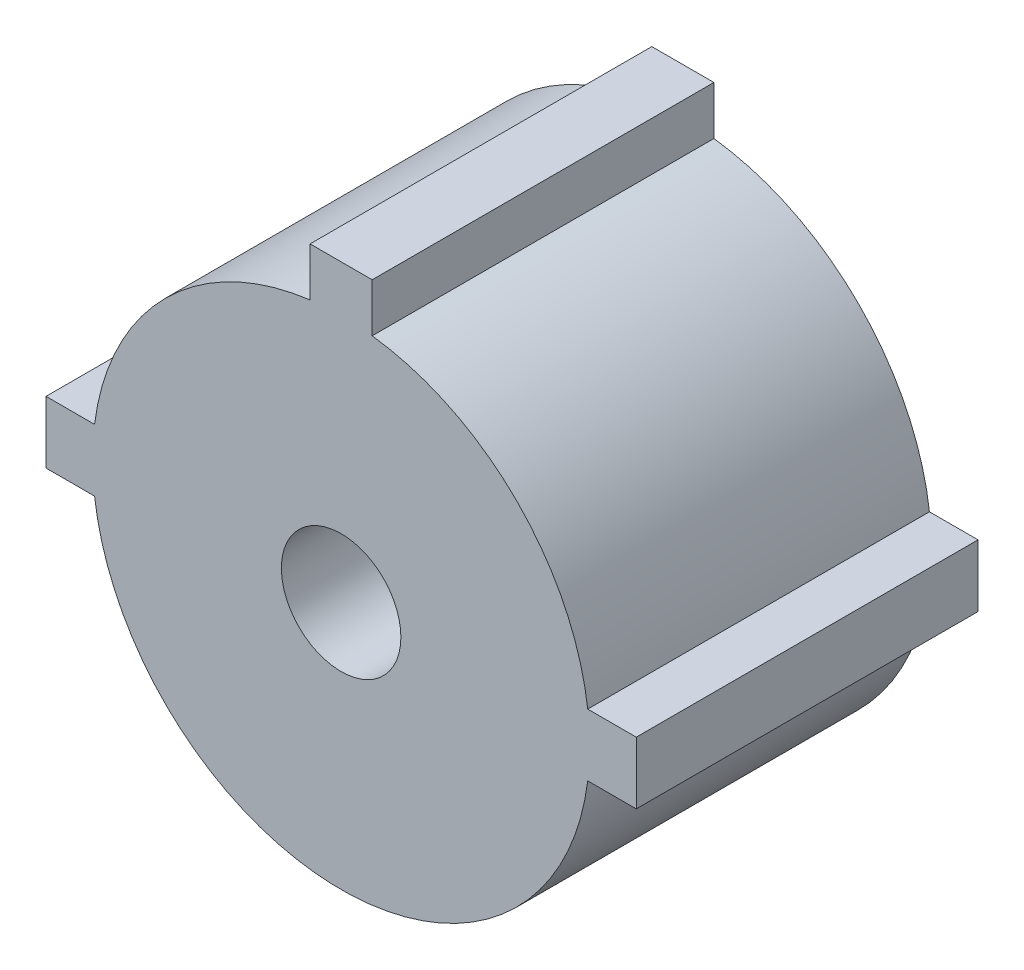
from build123d import *

# Parameters (mm, degrees)
BOSS_EXTRUDE1_DEPTH = 5.5


with BuildPart() as part:
    # Sketch1 → Boss-Extrude1 (new body)
    with BuildSketch(Plane.XY):
        with BuildLine():
            Line((-0.821374058, -0.5), (-3.968626967, -0.5))
            ThreePointArc((-3.968626967, -0.5), (0, -4), (3.968626967, -0.5))
            Line((3.968626967, -0.5), (0.821374058, -0.5))
            ThreePointArc((0.821374058, -0.5), (0, -0.961590008), (-0.821374058, -0.5))
        make_face()
        with BuildLine():
            ThreePointArc((-0.5, 3.968626967), (-2.828427125, 2.828427125), (-3.968626967, 0.5))
            Line((-3.968626967, 0.5), (-0.821374058, 0.5))
            ThreePointArc((-0.821374058, 0.5), (-0.679946815, 0.679946815), (-0.5, 0.821374058))
            Line((-0.5, 0.821374058), (-0.5, 3.968626967))
        make_face()
        with BuildLine():
            ThreePointArc((3.968626967, 0.5), (2.828427125, 2.828427125), (0.5, 3.968626967))
            Line((0.5, 3.968626967), (0.5, 0.821374058))
            ThreePointArc((0.5, 0.821374058), (0.679946815, 0.679946815), (0.821374058, 0.5))
            Line((0.821374058, 0.5), (3.968626967, 0.5))
        make_face()
        with BuildLine():
            Line((-0.821374058, 0.5), (-3.968626967, 0.5))
            ThreePointArc((-3.968626967, 0.5), (-4, 0), (-3.968626967, -0.5))
            Line((-3.968626967, -0.5), (-0.821374058, -0.5))
            ThreePointArc((-0.821374058, -0.5), (-0.961590008, 0), (-0.821374058, 0.5))
        make_face()
        with BuildLine():
            Line((0.821374058, -0.5), (3.968626967, -0.5))
            ThreePointArc((3.968626967, -0.5), (3.992149037, -0.25049165), (4, 0))
            ThreePointArc((4, 0), (3.992149037, 0.25049165), (3.968626967, 0.5))
            Line((3.968626967, 0.5), (0.821374058, 0.5))
            ThreePointArc((0.821374058, 0.5), (0.925872678, 0.259644234), (0.961590008, 0))
            ThreePointArc((0.961590008, 0), (0.925872678, -0.259644234), (0.821374058, -0.5))
        make_face()
        with BuildLine():
            ThreePointArc((0.5, 3.968626967), (0, 4), (-0.5, 3.968626967))
            Line((-0.5, 3.968626967), (-0.5, 0.821374058))
            ThreePointArc((-0.5, 0.821374058), (0, 0.961590008), (0.5, 0.821374058))
            Line((0.5, 0.821374058), (0.5, 3.968626967))
        make_face()
        with BuildLine():
            Line((-3.968626967, 0.5), (-4.75, 0.5))
            Line((-4.75, 0.5), (-4.75, -0.5))
            Line((-4.75, -0.5), (-3.968626967, -0.5))
            ThreePointArc((-3.968626967, -0.5), (-4, 0), (-3.968626967, 0.5))
        make_face()
        with BuildLine():
            ThreePointArc((4, 0), (3.992149037, -0.25049165), (3.968626967, -0.5))
            Line((3.968626967, -0.5), (4.75, -0.5))
            Line((4.75, -0.5), (4.75, 0.5))
            Line((4.75, 0.5), (3.968626967, 0.5))
            ThreePointArc((3.968626967, 0.5), (3.992149037, 0.25049165), (4, 0))
        make_face()
        with BuildLine():
            Line((-0.5, 4.75), (-0.5, 3.968626967))
            ThreePointArc((-0.5, 3.968626967), (0, 4), (0.5, 3.968626967))
            Line((0.5, 3.968626967), (0.5, 4.75))
            Line((0.5, 4.75), (-0.5, 4.75))
        make_face()
    extrude(amount=BOSS_EXTRUDE1_DEPTH)


solid = part.part
